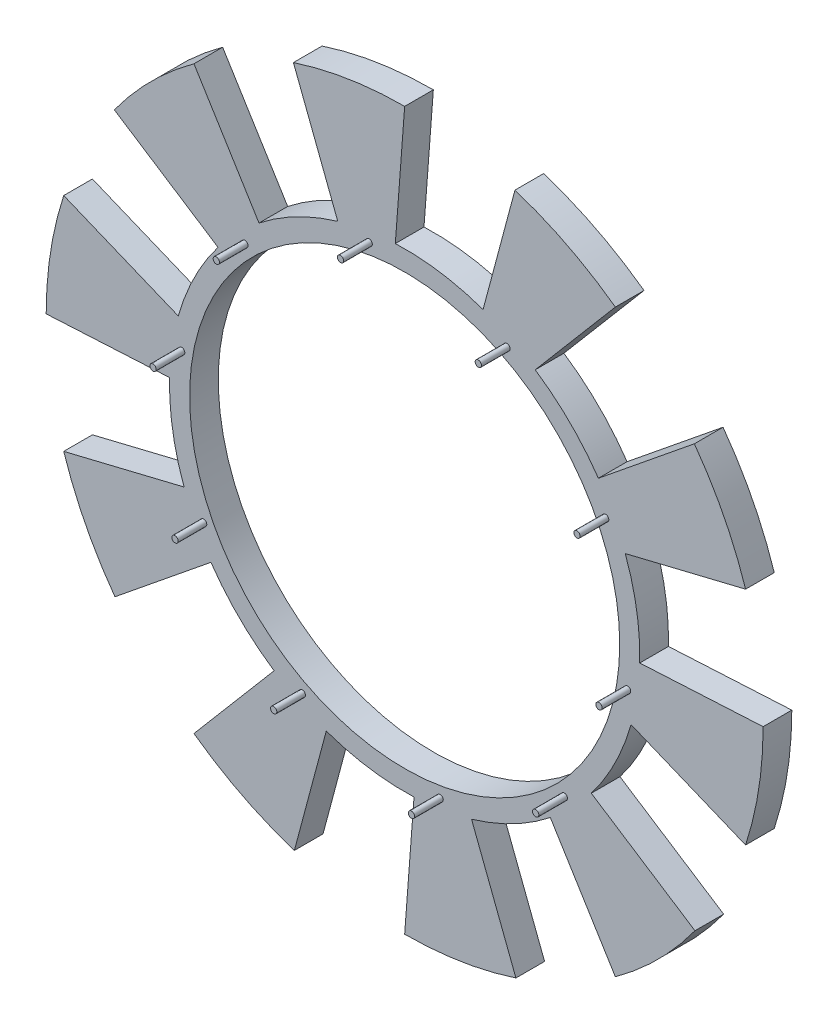
from build123d import *

# Parameters (mm, degrees)
SKETCH1_R            = 16.4
BOSS_EXTRUDE7_DEPTH  = 2
BOSS_EXTRUDE9_DEPTH  = 2
CIRPATTERN3_COUNT    = 10
SKETCH8_R            = 15
CUT_EXTRUDE6_DEPTH   = 2
SKETCH9_R            = 0.219012447
BOSS_EXTRUDE10_DEPTH = 2
CIRPATTERN4_COUNT    = 10


with BuildPart() as part:
    # Sketch1 → Boss-Extrude7 (new body)
    with BuildSketch(Plane.XY):
        Circle(SKETCH1_R)
    boss_extrude7 = extrude(amount=BOSS_EXTRUDE7_DEPTH)

    # Sketch7 → Boss-Extrude9 (add)
    with BuildSketch(Plane(origin=(0, 0, 0), x_dir=(-1, 0, 0), z_dir=(0, 0, -1))):
        with BuildLine():
            Line((7.758615453, 23.765603006), (4.664676273, 15.722620496))
            ThreePointArc((4.664676273, 15.722620496), (2.678892521, 16.179726044), (0.651751249, 16.387044282))
            Line((0.651751249, 16.387044282), (0, 25))
            ThreePointArc((0, 25), (3.928099085, 24.689472201), (7.758615453, 23.765603006))
        make_face()
    boss_extrude9 = extrude(amount=-BOSS_EXTRUDE9_DEPTH)

    # CirPattern3: Boss-Extrude7, Boss-Extrude9 ×10 about axis
    cirpattern3_axis = Axis((0, 0, 0), (0, 0, 1))
    add([boss_extrude7.rotate(cirpattern3_axis, i * 360 / CIRPATTERN3_COUNT) for i in range(1, CIRPATTERN3_COUNT)])
    add([boss_extrude9.rotate(cirpattern3_axis, i * 360 / CIRPATTERN3_COUNT) for i in range(1, CIRPATTERN3_COUNT)])

    # Sketch8 → Cut-Extrude6 (cut)
    with BuildSketch(Plane.XY.offset(2)):
        Circle(SKETCH8_R)
    extrude(amount=-CUT_EXTRUDE6_DEPTH, mode=Mode.SUBTRACT)

    # Sketch9 → Boss-Extrude10 (add)
    with BuildSketch(Plane.XY.offset(2)):
        with Locations((-2.473101921, 15.544307771)):
            Circle(SKETCH9_R)
    boss_extrude10 = extrude(amount=BOSS_EXTRUDE10_DEPTH)

    # CirPattern4: Boss-Extrude10 ×10 about axis
    cirpattern4_axis = Axis((0, 0, 0), (0, 0, 1))
    for i in range(1, CIRPATTERN4_COUNT):
        add(boss_extrude10.rotate(cirpattern4_axis, i * 360 / CIRPATTERN4_COUNT))


solid = part.part
